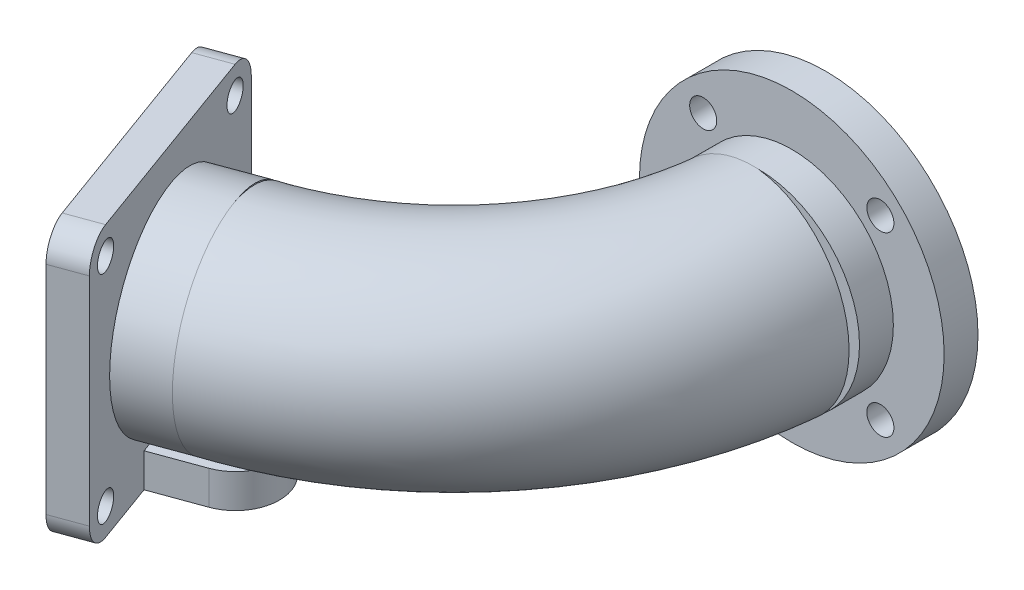
from build123d import *

# Parameters (mm, degrees)
SKETCH1_R                = 22.5
SKETCH1_R_2              = 15
SKETCH1_R_3              = 2
BOSS_EXTRUDE1_DEPTH      = 5
BOSS_EXTRUDE2_DEPTH      = 10
BOSS_EXTRUDE2_DEPTH_BACK = 2.5
SKETCH1_2_R              = 15
SKETCH4_R                = 2
SKETCH4_R_2              = 15
BOSS_EXTRUDE3_DEPTH      = 5
SKETCH4_3_R              = 15
BOSS_EXTRUDE4_DEPTH      = 12.5
SWEEP3_PROFILE_R         = 15
SKETCH22_R               = 3
BOSS_EXTRUDE5_DEPTH      = 4.99
SKETCH24_R               = 10


with BuildPart() as part:
    # Sketch1 → Boss-Extrude1 (new body)
    with BuildSketch(Plane.XY):
        Circle(SKETCH1_R)
        Circle(SKETCH1_R_2, mode=Mode.SUBTRACT)
        with Locations((13.081475452, 13.081475452)):
            Circle(SKETCH1_R_3, mode=Mode.SUBTRACT)
        with Locations((-13.081475452, 13.081475452)):
            Circle(SKETCH1_R_3, mode=Mode.SUBTRACT)
        with Locations((-13.081475452, -13.081475452)):
            Circle(SKETCH1_R_3, mode=Mode.SUBTRACT)
        with Locations((13.081475452, -13.081475452)):
            Circle(SKETCH1_R_3, mode=Mode.SUBTRACT)
    extrude(amount=BOSS_EXTRUDE1_DEPTH)

    # Sketch1<2> → Boss-Extrude2 (add, two sides: drawn at the far end of the back side and taken through both)
    with BuildSketch(Plane.XY.offset(-BOSS_EXTRUDE2_DEPTH_BACK)):
        Circle(SKETCH1_2_R)
    extrude(amount=BOSS_EXTRUDE2_DEPTH + BOSS_EXTRUDE2_DEPTH_BACK)



with BuildPart() as body_2:
    # Sketch4 → Boss-Extrude3 (new body)
    with BuildSketch(Plane(origin=(-59.111206886, 0, 21.514719818), x_dir=(0, -1, 0), z_dir=(-0.9396926207859094, 0, 0.34202014332566616))):
        with BuildLine():
            ThreePointArc((-20, 21.746291113), (-18.828427125, 18.917863989), (-16, 17.746291113))
            Line((-16, 17.746291113), (16, 17.746291113))
            ThreePointArc((16, 17.746291113), (18.828427125, 18.917863989), (20, 21.746291113))
            Line((20, 21.746291113), (20, 53.746291113))
            ThreePointArc((20, 53.746291113), (18.828427125, 56.574718238), (16, 57.746291113))
            Line((16, 57.746291113), (-16, 57.746291113))
            ThreePointArc((-16, 57.746291113), (-18.828427125, 56.574718238), (-20, 53.746291113))
            Line((-20, 53.746291113), (-20, 21.746291113))
        make_face()
        with Locations((-16, 21.746291113)):
            Circle(SKETCH4_R, mode=Mode.SUBTRACT)
        with Locations((16, 21.746291113)):
            Circle(SKETCH4_R, mode=Mode.SUBTRACT)
        with Locations((-16, 53.746291113)):
            Circle(SKETCH4_R, mode=Mode.SUBTRACT)
        with Locations((0, 37.746291113)):
            Circle(SKETCH4_R_2, mode=Mode.SUBTRACT)
        with Locations((16, 53.746291113)):
            Circle(SKETCH4_R, mode=Mode.SUBTRACT)
    extrude(amount=-BOSS_EXTRUDE3_DEPTH)

    # Sketch4<3> → Boss-Extrude4 (add)
    with BuildSketch(Plane(origin=(-59.111206886, 0, 21.514719818), x_dir=(0, -1, 0), z_dir=(-0.9396926207859094, 0, 0.34202014332566616))):
        with Locations((0, 37.746291113)):
            Circle(SKETCH4_3_R)
    extrude(amount=-BOSS_EXTRUDE4_DEPTH)


with BuildPart() as part_1:
    add(part.part)

    add(body_2.part)  # Sweep3 merges body 2
    # Sweep3: sweep along a curve in space
    with BuildLine() as sweep3_path:
        ThreePointArc((0, 0, 10), (-10.844948453, 0, 36.503726407), (-34.45505723, 0, 52.709379248))
    # Sweep3 profile (on start of the path) → Sweep3 (sweep)
    with BuildSketch(Plane(origin=(0, 0, 10), x_dir=(0.9952050551288538, 0, 0.09781052216390201), z_dir=(-0.09781052216390201, 0, 0.9952050551288538))):
        Circle(SWEEP3_PROFILE_R)
    sweep(path=sweep3_path.line)

    # Sketch22 → Boss-Extrude5 (add)
    with BuildSketch(Plane.XZ.offset(20)):
        with BuildLine():
            Line((-32.231926298, 58.817381283), (-39.279620954, 61.382532358))
            Line((-39.279620954, 61.382532358), (-43.725882817, 49.166528288))
            Line((-43.725882817, 49.166528288), (-36.678188161, 46.601377213))
            ThreePointArc((-36.678188161, 46.601377213), (-28.347055195, 50.486248316), (-32.231926298, 58.817381283))
        make_face()
        with Locations((-34.45505723, 52.709379248)):
            Circle(SKETCH22_R, mode=Mode.SUBTRACT)
    extrude(amount=-BOSS_EXTRUDE5_DEPTH)

    # Sketch24 → Cut-Revolve1 (revolve, cut)
    with BuildSketch(Plane.XY.offset(10)):
        Circle(SKETCH24_R)
    revolve(axis=Axis((-50, 66.423618384, 10), (0, -1, 0)), mode=Mode.SUBTRACT)


solid = part_1.part
